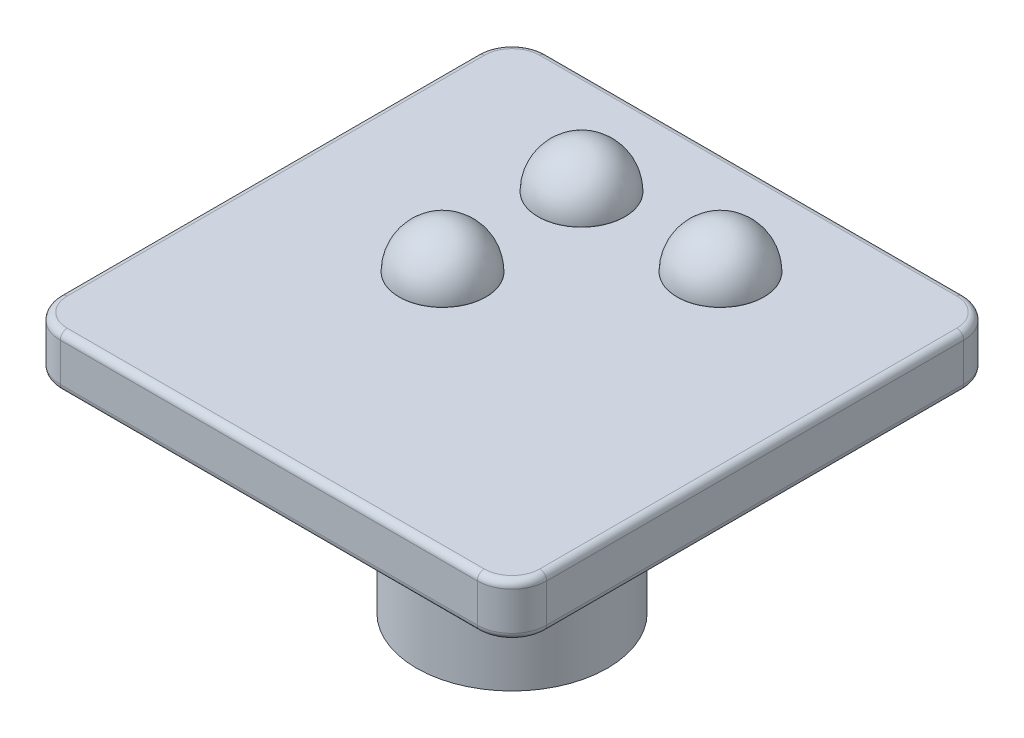
from build123d import *

# Parameters (mm, degrees)
BOSS_EXTRUDE1_DEPTH = 1.5
SKETCH2_R           = 2.75
BOSS_EXTRUDE2_DEPTH = 6
SKETCH3_W           = 1.1
SKETCH3_H           = 1.45
SKETCH3_W_2         = 1.45
SKETCH3_H_2         = 1.1
CUT_EXTRUDE1_DEPTH  = 6
CHAMFER1_SIZE       = 0.3
FILLET1_R           = 1
SKETCH4_R           = 1.25
BOSS_EXTRUDE3_DEPTH = 0.01
DOME1_FACE_RADIUS   = 1.25
DOME1_HEIGHT        = 1.25
DOME2_FACE_RADIUS   = 1.25
DOME2_HEIGHT        = 1.25
DOME3_FACE_RADIUS   = 1.25
DOME3_HEIGHT        = 1.25
FILLET3_R           = 0.2


with BuildPart() as part:
    # Sketch1 → Boss-Extrude1 (new body)
    with BuildSketch(Plane(origin=(0, 0, 0), x_dir=(1, 0, 0), z_dir=(0, 1, 0))):
        with BuildLine():
            Line((-7.324675649, 4.396717546), (4.675324351, 4.396717546))
            ThreePointArc((4.675324351, 4.396717546), (5.382431132, 4.103824327), (5.675324351, 3.396717546))
            Line((5.675324351, 3.396717546), (5.675324351, -8.603282454))
            ThreePointArc((5.675324351, -8.603282454), (5.382431132, -9.310389235), (4.675324351, -9.603282454))
            Line((4.675324351, -9.603282454), (-7.324675649, -9.603282454))
            ThreePointArc((-7.324675649, -9.603282454), (-8.03178243, -9.310389235), (-8.324675649, -8.603282454))
            Line((-8.324675649, -8.603282454), (-8.324675649, 3.396717546))
            ThreePointArc((-8.324675649, 3.396717546), (-8.03178243, 4.103824327), (-7.324675649, 4.396717546))
        make_face()
    extrude(amount=BOSS_EXTRUDE1_DEPTH)

    # Sketch2 → Boss-Extrude2 (add)
    with BuildSketch(Plane.XZ):
        with Locations(Location((-1.324675649, 2.603282454, 0), (0, 0, 270))):
            Circle(SKETCH2_R)
    extrude(amount=BOSS_EXTRUDE2_DEPTH)

    # Sketch3 → Cut-Extrude1 (cut)
    with BuildSketch(Plane.XZ.offset(6)):
        with Locations((-1.324675649, 3.878282454)):
            Rectangle(SKETCH3_W, SKETCH3_H)
        with Locations((-0.049675649, 2.603282454)):
            Rectangle(SKETCH3_W_2, SKETCH3_H_2)
        with Locations((-1.324675649, 2.603282454)):
            Rectangle(SKETCH3_W, SKETCH3_H_2)
        with Locations((-2.599675649, 2.603282454)):
            Rectangle(SKETCH3_W_2, SKETCH3_H_2)
        with Locations((-1.324675649, 1.328282454)):
            Rectangle(SKETCH3_W, SKETCH3_H)
    extrude(amount=-CUT_EXTRUDE1_DEPTH, mode=Mode.SUBTRACT)

    # Chamfer1
    chamfer1_edges = [part.edges().sort_by_distance(p)[0] for p in [
        (-0.774675649, -6, 3.878282454),
        (-0.049675649, -6, 3.153282454),
        (0.675324351, -6, 2.603282454),
        (-0.774675649, -6, 1.328282454),
        (-2.599675649, -6, 3.153282454),
        (-1.324675649, -6, 4.603282454),
        (-1.874675649, -6, 3.878282454),
        (-3.324675649, -6, 2.603282454),
        (-2.599675649, -6, 2.053282454),
        (-1.874675649, -6, 1.328282454),
        (-1.324675649, -6, 0.603282454),
        (-0.049675649, -6, 2.053282454),
    ]]
    chamfer(chamfer1_edges, length=CHAMFER1_SIZE)

    # Fillet1
    fillet1_edges = [part.edges().sort_by_distance(p)[0] for p in [
        (-1.324675649, 0, 5.353282454),
    ]]
    fillet(fillet1_edges, radius=FILLET1_R)

    # Sketch4 → Boss-Extrude3 (add)
    with BuildSketch(Plane(origin=(0, 1.5, 0), x_dir=(1, 0, 0), z_dir=(0, 1, 0))):
        with Locations(Location((-3.324675649, 1.396717546, 0), (0, 0, 90))):
            Circle(SKETCH4_R)
        with Locations(Location((-3.324675649, -2.603282454, 0), (0, 0, 90))):
            Circle(SKETCH4_R)
        with Locations(Location((0.675324351, 1.396717546, 0), (0, 0, 90))):
            Circle(SKETCH4_R)
    extrude(amount=BOSS_EXTRUDE3_DEPTH)

    # Dome1: a dome of height H over a round flat face of radius A is a cap of a sphere of radius (A * A + H * H) / (2 * H)
    dome1_r = (DOME1_FACE_RADIUS * DOME1_FACE_RADIUS + DOME1_HEIGHT * DOME1_HEIGHT) / (2 * DOME1_HEIGHT)
    dome1_base = Plane((-3.324675649, 1.51, -1.396717546), z_dir=(0, 1, 0))
    with Locations(dome1_base.offset(DOME1_HEIGHT - dome1_r)):
        dome1_ball = Sphere(dome1_r, mode=Mode.PRIVATE)
    add(split(dome1_ball, bisect_by=dome1_base, keep=Keep.TOP, mode=Mode.PRIVATE))

    # Dome2: a dome of height H over a round flat face of radius A is a cap of a sphere of radius (A * A + H * H) / (2 * H)
    dome2_r = (DOME2_FACE_RADIUS * DOME2_FACE_RADIUS + DOME2_HEIGHT * DOME2_HEIGHT) / (2 * DOME2_HEIGHT)
    dome2_base = Plane((0.675324351, 1.51, -1.396717546), z_dir=(0, 1, 0))
    with Locations(dome2_base.offset(DOME2_HEIGHT - dome2_r)):
        dome2_ball = Sphere(dome2_r, mode=Mode.PRIVATE)
    add(split(dome2_ball, bisect_by=dome2_base, keep=Keep.TOP, mode=Mode.PRIVATE))

    # Dome3: a dome of height H over a round flat face of radius A is a cap of a sphere of radius (A * A + H * H) / (2 * H)
    dome3_r = (DOME3_FACE_RADIUS * DOME3_FACE_RADIUS + DOME3_HEIGHT * DOME3_HEIGHT) / (2 * DOME3_HEIGHT)
    dome3_base = Plane((-3.324675649, 1.51, 2.603282454), z_dir=(0, 1, 0))
    with Locations(dome3_base.offset(DOME3_HEIGHT - dome3_r)):
        dome3_ball = Sphere(dome3_r, mode=Mode.PRIVATE)
    add(split(dome3_ball, bisect_by=dome3_base, keep=Keep.TOP, mode=Mode.PRIVATE))

    # Fillet3
    fillet3_edges = [part.edges().sort_by_distance(p)[0] for p in [
        (5.382431132, 1.5, 9.310389235),
        (-1.324675649, 0, 9.603282454),
        (-8.03178243, 0, 9.310389235),
        (5.675324351, 1.5, 2.603282454),
        (5.382431132, 1.5, -4.103824327),
        (-1.324675649, 1.5, -4.396717546),
        (-8.03178243, 1.5, -4.103824327),
        (-8.324675649, 1.5, 2.603282454),
        (-8.03178243, 1.5, 9.310389235),
        (-1.324675649, 1.5, 9.603282454),
        (-8.324675649, 0, 2.603282454),
        (-8.03178243, 0, -4.103824327),
        (-1.324675649, 0, -4.396717546),
        (5.382431132, 0, -4.103824327),
        (5.675324351, 0, 2.603282454),
        (5.382431132, 0, 9.310389235),
    ]]
    fillet(fillet3_edges, radius=FILLET3_R)


solid = part.part
